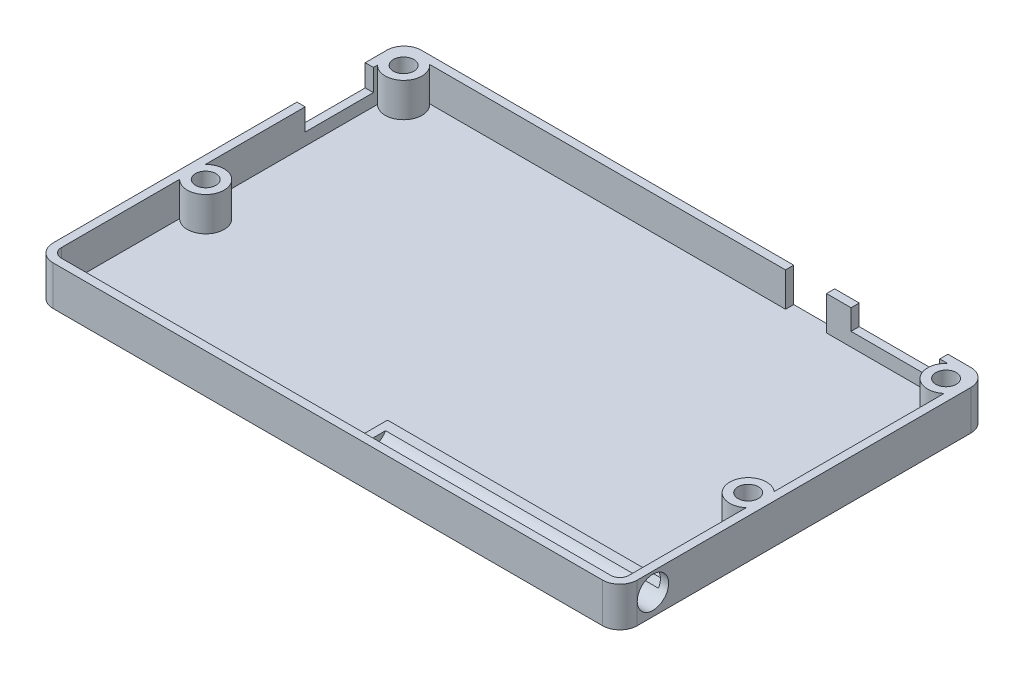
from build123d import *

# Parameters (mm, degrees)
BOSS_EXTRUDE1_DEPTH = 0.8
BOSS_EXTRUDE2_DEPTH = 5
SKETCH4_W           = 10
SKETCH4_H           = 3.2
CUT_EXTRUDE1_DEPTH  = 1.2
SKETCH6_W           = 6
SKETCH6_H           = 5
CUT_EXTRUDE2_DEPTH  = 1.2
SKETCH7_W           = 13
SKETCH7_H           = 3
CUT_EXTRUDE3_DEPTH  = 1.2
SKETCH8_R           = 2.7
SKETCH8_R_2         = 1.5
BOSS_EXTRUDE4_DEPTH = 5
SKETCH9_R           = 2.7
SKETCH9_R_2         = 1.5
BOSS_EXTRUDE5_DEPTH = 5
SKETCH10_R          = 2.7
SKETCH10_R_2        = 1.5
BOSS_EXTRUDE6_DEPTH = 5
SKETCH11_R          = 2.7
SKETCH11_R_2        = 1.5
BOSS_EXTRUDE7_DEPTH = 5
SKETCH13_R          = 2.3
CUT_EXTRUDE8_DEPTH  = 5
SKETCH15_W          = 41.2
SKETCH15_H          = 7.14
BOSS_EXTRUDE9_DEPTH = 1.2
SKETCH16_R          = 2.3
CUT_EXTRUDE9_DEPTH  = 40


with BuildPart() as part:
    # Sketch1 → Boss-Extrude1 (new body)
    with BuildSketch(Plane(origin=(0, 0, 0), x_dir=(1, 0, 0), z_dir=(0, 1, 0))):
        with BuildLine():
            Line((62.865, 49.276), (62.865, 98.171))
            ThreePointArc((62.865, 98.171), (63.608948776, 99.967051224), (65.405, 100.711))
            Line((65.405, 100.711), (145.923, 100.711))
            ThreePointArc((145.923, 100.711), (147.719051224, 99.967051224), (148.463, 98.171))
            Line((148.463, 98.171), (148.463, 49.276))
            ThreePointArc((148.463, 49.276), (147.719051224, 47.479948776), (145.923, 46.736))
            Line((145.923, 46.736), (65.405, 46.736))
            ThreePointArc((65.405, 46.736), (63.608948776, 47.479948776), (62.865, 49.276))
        make_face()
    extrude(amount=BOSS_EXTRUDE1_DEPTH)

    # Sketch3 → Boss-Extrude2 (add)
    with BuildSketch(Plane(origin=(0, 0.8, 0), x_dir=(1, 0, 0), z_dir=(0, 1, 0))):
        with BuildLine():
            Line((65.405, 46.736), (145.923, 46.736))
            ThreePointArc((145.923, 46.736), (147.719051224, 47.479948776), (148.463, 49.276))
            Line((148.463, 49.276), (148.463, 98.171))
            ThreePointArc((148.463, 98.171), (147.719051224, 99.967051224), (145.923, 100.711))
            Line((145.923, 100.711), (65.405, 100.711))
            ThreePointArc((65.405, 100.711), (63.608948776, 99.967051224), (62.865, 98.171))
            Line((62.865, 98.171), (62.865, 49.276))
            ThreePointArc((62.865, 49.276), (63.608948776, 47.479948776), (65.405, 46.736))
        make_face()
        with BuildLine():
            Line((64.065, 98.171), (64.065, 49.276))
            ThreePointArc((64.065, 49.276), (64.457476913, 48.328476913), (65.405, 47.936))
            Line((65.405, 47.936), (145.923, 47.936))
            ThreePointArc((145.923, 47.936), (146.870523087, 48.328476913), (147.263, 49.276))
            Line((147.263, 49.276), (147.263, 98.171))
            ThreePointArc((147.263, 98.171), (146.870523087, 99.118523087), (145.923, 99.511))
            Line((145.923, 99.511), (65.405, 99.511))
            ThreePointArc((65.405, 99.511), (64.457476913, 99.118523087), (64.065, 98.171))
        make_face(mode=Mode.SUBTRACT)
    extrude(amount=BOSS_EXTRUDE2_DEPTH)

    # Sketch4 → Cut-Extrude1 (cut)
    with BuildSketch(Plane.ZY.offset(-62.865)):
        with Locations((-90.011, 4.2)):
            Rectangle(SKETCH4_W, SKETCH4_H)
    extrude(amount=-CUT_EXTRUDE1_DEPTH, mode=Mode.SUBTRACT)

    # Sketch6 → Cut-Extrude2 (cut)
    with BuildSketch(Plane(origin=(0, 0, -100.711), x_dir=(-1, 0, 0), z_dir=(0, 0, -1))):
        with Locations((-122.963, 3.3)):
            Rectangle(SKETCH6_W, SKETCH6_H)
    extrude(amount=-CUT_EXTRUDE2_DEPTH, mode=Mode.SUBTRACT)

    # Sketch7 → Cut-Extrude3 (cut)
    with BuildSketch(Plane(origin=(0, 0, -100.711), x_dir=(-1, 0, 0), z_dir=(0, 0, -1))):
        with Locations((-136.063, 4.3)):
            Rectangle(SKETCH7_W, SKETCH7_H)
    extrude(amount=-CUT_EXTRUDE3_DEPTH, mode=Mode.SUBTRACT)

    # Sketch8 → Boss-Extrude4 (add)
    with BuildSketch(Plane(origin=(0, 0.8, 0), x_dir=(1, 0, 0), z_dir=(0, 1, 0))):
        with Locations((66.015, 97.486)):
            Circle(SKETCH8_R)
        with Locations(Location((66.015, 97.486, 0), (0, 0, 270))):
            Circle(SKETCH8_R_2, mode=Mode.SUBTRACT)
    extrude(amount=BOSS_EXTRUDE4_DEPTH)

    # Sketch9 → Boss-Extrude5 (add)
    with BuildSketch(Plane(origin=(0, 0.8, 0), x_dir=(1, 0, 0), z_dir=(0, 1, 0))):
        with Locations((145.5, 97.5)):
            Circle(SKETCH9_R)
        with Locations(Location((145.5, 97.5, 0), (0, 0, 270))):
            Circle(SKETCH9_R_2, mode=Mode.SUBTRACT)
    extrude(amount=BOSS_EXTRUDE5_DEPTH)

    # Sketch10 → Boss-Extrude6 (add)
    with BuildSketch(Plane(origin=(0, 0.8, 0), x_dir=(1, 0, 0), z_dir=(0, 1, 0))):
        with Locations((66, 68.5)):
            Circle(SKETCH10_R)
        with Locations(Location((66, 68.5, 0), (0, 0, 270))):
            Circle(SKETCH10_R_2, mode=Mode.SUBTRACT)
    extrude(amount=BOSS_EXTRUDE6_DEPTH)

    # Sketch11 → Boss-Extrude7 (add)
    with BuildSketch(Plane(origin=(0, 0.8, 0), x_dir=(1, 0, 0), z_dir=(0, 1, 0))):
        with Locations((145.5, 68.5)):
            Circle(SKETCH11_R)
        with Locations(Location((145.5, 68.5, 0), (0, 0, 270))):
            Circle(SKETCH11_R_2, mode=Mode.SUBTRACT)
    extrude(amount=BOSS_EXTRUDE7_DEPTH)

    # Sketch13 → Cut-Extrude8 (cut)
    with BuildSketch(Plane(origin=(148.463, 0, 0), x_dir=(0, 0, -1), z_dir=(1, 0, 0))):
        with Locations(Location((51.576, 3.1, 0), (0, 0, 180))):
            Circle(SKETCH13_R)
    extrude(amount=-CUT_EXTRUDE8_DEPTH, mode=Mode.SUBTRACT)

    # Sketch15 → Boss-Extrude9 (add)
    with BuildSketch(Plane(origin=(0, 0.8, 0), x_dir=(1, 0, 0), z_dir=(0, 1, 0))):
        with Locations((126.663, 51.506)):
            Rectangle(SKETCH15_W, SKETCH15_H)
    extrude(amount=BOSS_EXTRUDE9_DEPTH)

    # Sketch16 → Cut-Extrude9 (cut)
    with BuildSketch(Plane(origin=(147.263, 0, 0), x_dir=(0, 0, -1), z_dir=(1, 0, 0))):
        with Locations(Location((51.576, 3.1, 0), (0, 0, 180))):
            Circle(SKETCH16_R)
    extrude(amount=-CUT_EXTRUDE9_DEPTH, mode=Mode.SUBTRACT)


solid = part.part
